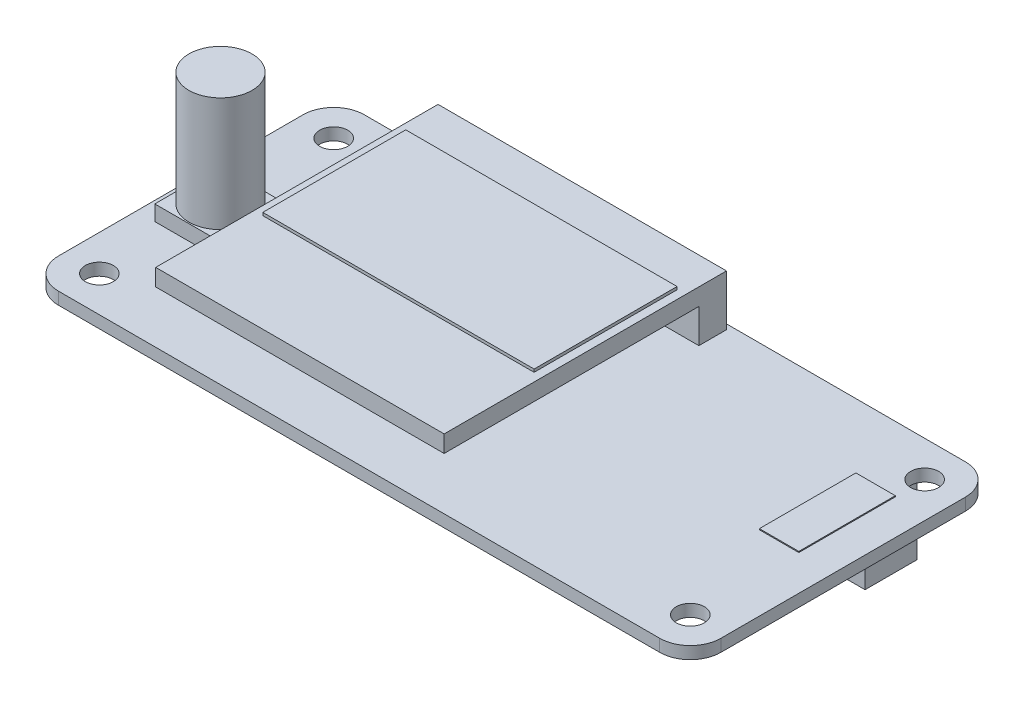
from build123d import *

# Parameters (mm, degrees)
EXTRUDE_1_DEPTH     = 1.2
SKETCH_2_R          = 1.375
CUT_EXTRUDE_1_DEPTH = 1.2
SKETCH_11_W         = 51.4
SKETCH_11_H         = 5.1
EXTRUDE_9_DEPTH     = 8.6
SKETCH_12_W         = 6.45
SKETCH_12_H         = 6.45
EXTRUDE_10_DEPTH    = 1.5
SKETCH_13_R         = 3.1
EXTRUDE_11_DEPTH    = 11.2
SKETCH_14_W         = 28.31
SKETCH_14_H         = 27.71
EXTRUDE_12_DEPTH    = 5
SKETCH_15_W         = 26.63
SKETCH_15_H         = 14.03
EXTRUDE_13_DEPTH    = 0.28
SKETCH_16_W         = 3.87
SKETCH_16_H         = 9.47
EXTRUDE_14_DEPTH    = 0.1
SKETCH_17_W         = 28.31
SKETCH_17_H         = 3.337027264
CUT_EXTRUDE_2_DEPTH = 25


with BuildPart() as part:
    # 草图1 → 凸台-拉伸1 (new body)
    with BuildSketch(Plane(origin=(0, 0, 0), x_dir=(1, 0, 0), z_dir=(0, 1, 0))):
        with BuildLine():
            Line((-29.5, 15), (29.5, 15))
            ThreePointArc((29.5, 15), (31.621320344, 14.121320344), (32.5, 12))
            Line((32.5, 12), (32.5, -12))
            ThreePointArc((32.5, -12), (31.621320344, -14.121320344), (29.5, -15))
            Line((29.5, -15), (-29.5, -15))
            ThreePointArc((-29.5, -15), (-31.621320344, -14.121320344), (-32.5, -12))
            Line((-32.5, -12), (-32.5, 12))
            ThreePointArc((-32.5, 12), (-31.621320344, 14.121320344), (-29.5, 15))
        make_face()
    extrude(amount=EXTRUDE_1_DEPTH)

    # 草图2 → 切除-拉伸1 (cut)
    with BuildSketch(Plane(origin=(0, 1.2, 0), x_dir=(1, 0, 0), z_dir=(0, 1, 0))):
        with Locations(Location((29, -11.5, 0), (0, 0, 270))):
            Circle(SKETCH_2_R)
        with Locations(Location((29, 11.5, 0), (0, 0, 270))):
            Circle(SKETCH_2_R)
        with Locations(Location((-29, -11.5, 0), (0, 0, 270))):
            Circle(SKETCH_2_R)
        with Locations(Location((-29, 11.5, 0), (0, 0, 270))):
            Circle(SKETCH_2_R)
    extrude(amount=-CUT_EXTRUDE_1_DEPTH, mode=Mode.SUBTRACT)

    # 草图11 → 凸台-拉伸9 (add)
    with BuildSketch(Plane.XZ):
        with Locations((-0.05, -11.55)):
            Rectangle(SKETCH_11_W, SKETCH_11_H)
    extrude(amount=EXTRUDE_9_DEPTH)

    # 草图12 → 凸台-拉伸10 (add)
    with BuildSketch(Plane(origin=(0, 1.2, 0), x_dir=(1, 0, 0), z_dir=(0, 1, 0))):
        with Locations((-27.475, -1.135)):
            Rectangle(SKETCH_12_W, SKETCH_12_H)
    extrude(amount=EXTRUDE_10_DEPTH)

    # 草图13 → 凸台-拉伸11 (add)
    with BuildSketch(Plane(origin=(0, 2.7, 0), x_dir=(1, 0, 0), z_dir=(0, 1, 0))):
        with Locations(Location((-27.475, -1.135, 0), (0, 0, 270))):
            Circle(SKETCH_13_R)
    extrude(amount=EXTRUDE_11_DEPTH)

    # 草图14 → 凸台-拉伸12 (add)
    with BuildSketch(Plane(origin=(0, 1.2, 0), x_dir=(1, 0, 0), z_dir=(0, 1, 0))):
        with Locations((-7.605, 0.645)):
            Rectangle(SKETCH_14_W, SKETCH_14_H)
    extrude(amount=EXTRUDE_12_DEPTH)

    # 草图15 → 凸台-拉伸13 (add)
    with BuildSketch(Plane(origin=(0, 6.2, 0), x_dir=(1, 0, 0), z_dir=(0, 1, 0))):
        with Locations((-7.585, 3.455)):
            Rectangle(SKETCH_15_W, SKETCH_15_H)
    extrude(amount=EXTRUDE_13_DEPTH)

    # 草图16 → 凸台-拉伸14 (add)
    with BuildSketch(Plane(origin=(0, 1.2, 0), x_dir=(1, 0, 0), z_dir=(0, 1, 0))):
        with Locations((27.105, 3.845)):
            Rectangle(SKETCH_16_W, SKETCH_16_H)
    extrude(amount=EXTRUDE_14_DEPTH)

    # 草图17 → 切除-拉伸2 (cut)
    with BuildSketch(Plane.XY.offset(13.21)):
        with Locations((-7.605, 2.868513632)):
            Rectangle(SKETCH_17_W, SKETCH_17_H)
    extrude(amount=-CUT_EXTRUDE_2_DEPTH, mode=Mode.SUBTRACT)


solid = part.part
